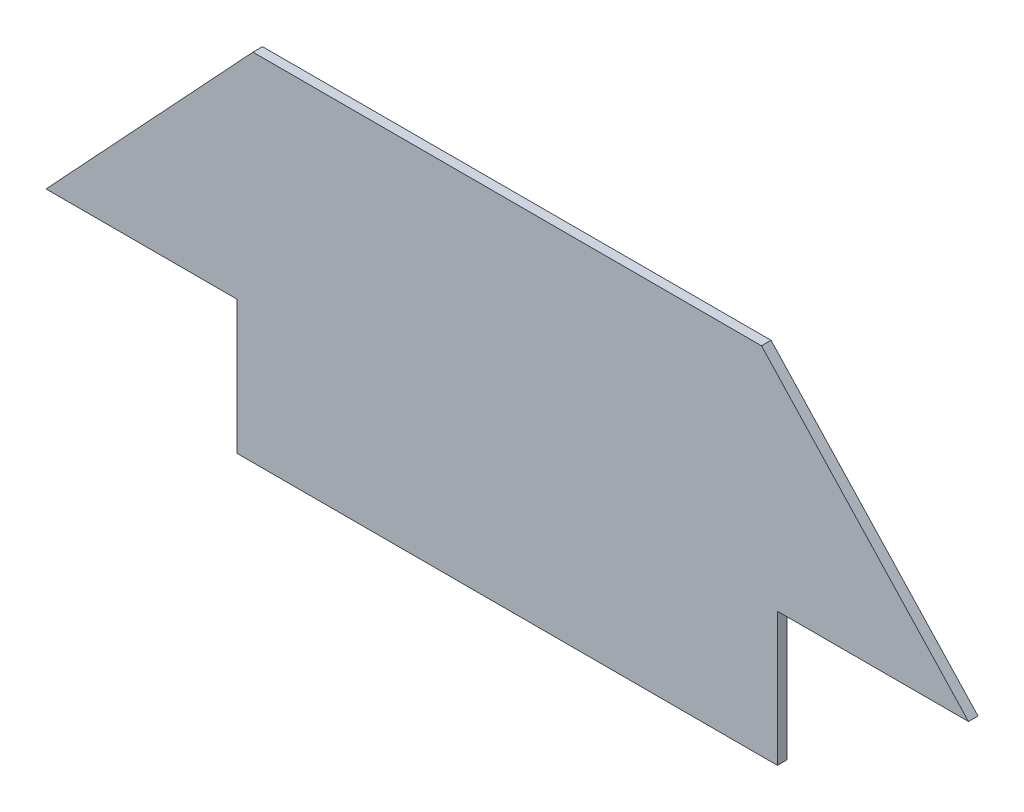
from build123d import *

# Parameters (mm, degrees)
EXTRUDE_1_DEPTH = 3


with BuildPart() as part:
    # 草图1 → 凸台-拉伸1 (new body)
    with BuildSketch(Plane.XY):
        Polygon((0, 0), (-80, 0), (-145.109322536, -69.821200219), (-85, -69.821200219), (-85, -111.821200219), (0, -111.821200219), align=None)
        Polygon((80, 0), (0, 0), (0, -111.821200219), (85, -111.821200219), (85, -69.821200219), (145.109322536, -69.821200219), align=None)
    extrude(amount=EXTRUDE_1_DEPTH)


solid = part.part
